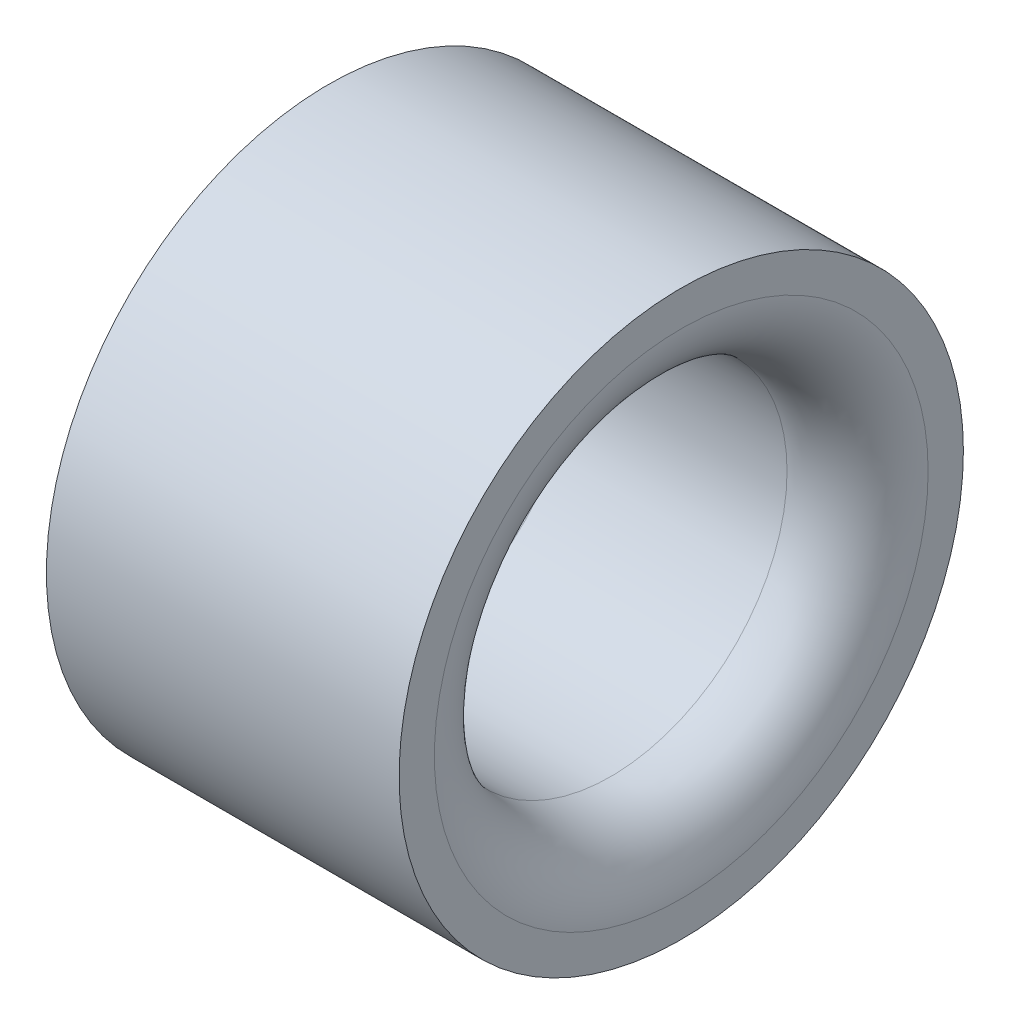
from build123d import *

# Parameters (mm, degrees)
SKETCH1_R           = 4
SKETCH1_R_2         = 2.5
BOSS_EXTRUDE1_DEPTH = 5
FILLET2_R           = 1


with BuildPart() as part:
    # Sketch1 → Boss-Extrude1 (new body)
    with BuildSketch(Plane(origin=(0, 0, 0), x_dir=(0, 0, -1), z_dir=(1, 0, 0))):
        Circle(SKETCH1_R)
        Circle(SKETCH1_R_2, mode=Mode.SUBTRACT)
    extrude(amount=BOSS_EXTRUDE1_DEPTH)

    # Fillet2
    fillet2_edges = [part.edges().sort_by_distance(p)[0] for p in [
        (0, 0, 2.5),
        (5, 0, 2.5),
    ]]
    fillet(fillet2_edges, radius=FILLET2_R)


solid = part.part
